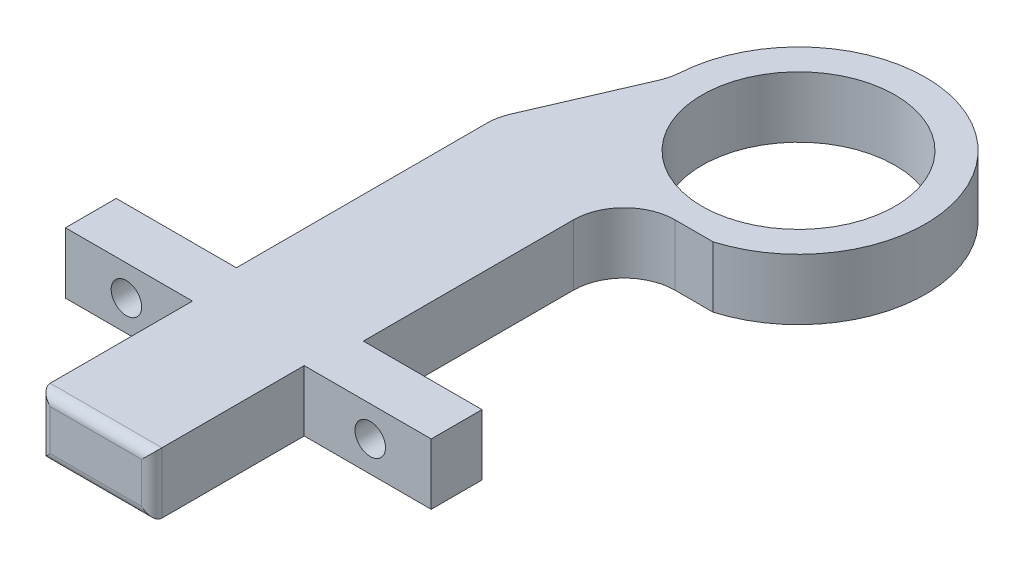
from build123d import *

# Parameters (mm, degrees)
CROQUIS1_R              = 9.5
SALIENTE_EXTRUIR1_DEPTH = 6
CROQUIS2_R              = 1.5
CORTAR_EXTRUIR1_DEPTH   = 6
REDONDEO1_R             = 1


with BuildPart() as part:
    # Croquis1 → Saliente-Extruir1 (new body)
    with BuildSketch(Plane(origin=(0, 0, 0), x_dir=(1, 0, 0), z_dir=(0, 1, 0))):
        with BuildLine():
            Line((-25.374701647, 20.783734094), (-29.767291136, 10.621141392))
            ThreePointArc((-29.767291136, 10.621141392), (-29.942112128, 10.153967486), (-30.069514751, 9.671699501))
            ThreePointArc((-30.069514751, 9.671699501), (-30.150557328, 9.157351254), (-30.17766953, 8.637363805))
            Line((-30.17766953, 8.637363805), (-30.17766953, -16))
            Line((-30.17766953, -16), (-42, -16))
            Line((-42, -16), (-42, -21))
            Line((-42, -21), (-29.5, -21))
            Line((-29.5, -21), (-29.5, -36))
            Line((-29.5, -36), (-18.5, -36))
            Line((-18.5, -36), (-18.5, -21))
            Line((-18.5, -21), (-6, -21))
            Line((-6, -21), (-6, -16))
            Line((-6, -16), (-17.67766953, -16))
            Line((-17.67766953, -16), (-17.67766953, 4.671699501))
            ThreePointArc((-17.67766953, 4.671699501), (-16.213203436, 8.207233407), (-12.67766953, 9.671699501))
            Line((-12.67766953, 9.671699501), (-8.928571429, 9.671699501))
            ThreePointArc((-8.928571429, 9.671699501), (-4.713647249, 31.429321655), (-24.974516609, 22.448404084))
            ThreePointArc((-24.974516609, 22.448404084), (-25.102827296, 21.598812807), (-25.374701647, 20.783734094))
        make_face()
        with Locations(Location((-12.5, 21.650635095, 0), (0, 0, 270))):
            Circle(CROQUIS1_R, mode=Mode.SUBTRACT)
    extrude(amount=SALIENTE_EXTRUIR1_DEPTH)

    # Croquis2 → Cortar-Extruir1 (cut)
    with BuildSketch(Plane.XY.offset(21)):
        with Locations((-36, 3)):
            Circle(CROQUIS2_R)
        with Locations((-12, 3)):
            Circle(CROQUIS2_R)
    extrude(amount=-CORTAR_EXTRUIR1_DEPTH, mode=Mode.SUBTRACT)

    # Redondeo1
    redondeo1_edges = [part.edges().sort_by_distance(p)[0] for p in [
        (-24, 0, 36),
        (-18.5, 3, 36),
        (-29.5, 3, 36),
        (-24, 6, 36),
    ]]
    fillet(redondeo1_edges, radius=REDONDEO1_R)


solid = part.part
